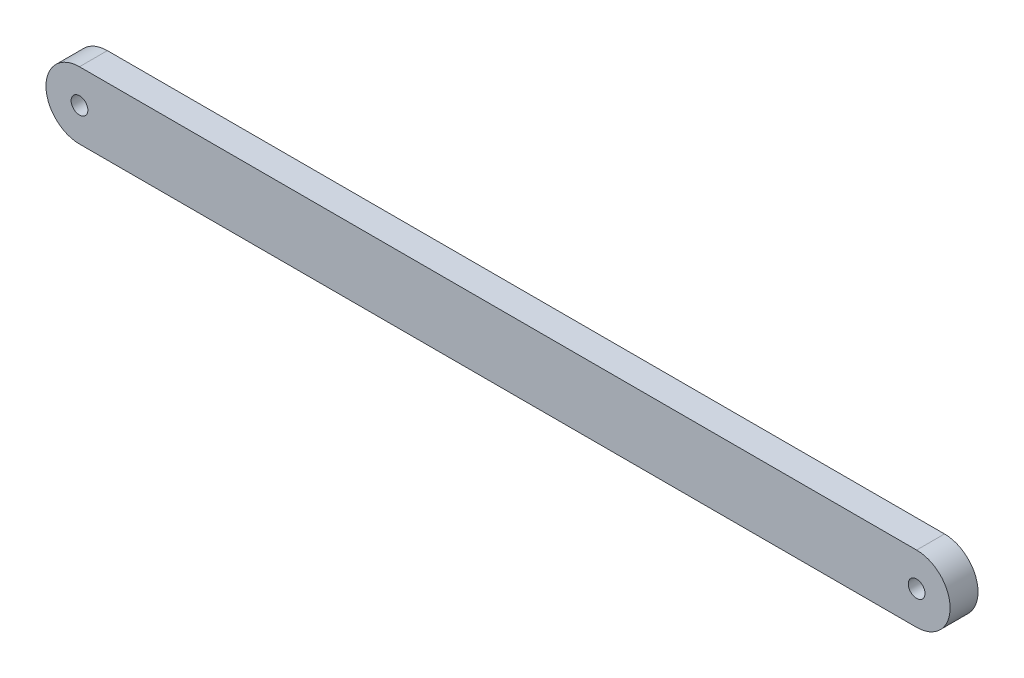
from build123d import *

# Parameters (mm, degrees)
ESQUISSE1_R        = 1.5
BOSS_EXTRU_1_DEPTH = 5


with BuildPart() as part:
    # Esquisse1 → Boss.-Extru.1 (new body)
    with BuildSketch(Plane.XY):
        with BuildLine():
            Line((-75, 6), (75, 6))
            ThreePointArc((75, 6), (81, 0), (75, -6))
            Line((75, -6), (-75, -6))
            ThreePointArc((-75, -6), (-81, 0), (-75, 6))
        make_face()
        with Locations((-75, 0)):
            Circle(ESQUISSE1_R, mode=Mode.SUBTRACT)
        with Locations((75, 0)):
            Circle(ESQUISSE1_R, mode=Mode.SUBTRACT)
    extrude(amount=BOSS_EXTRU_1_DEPTH)


solid = part.part
